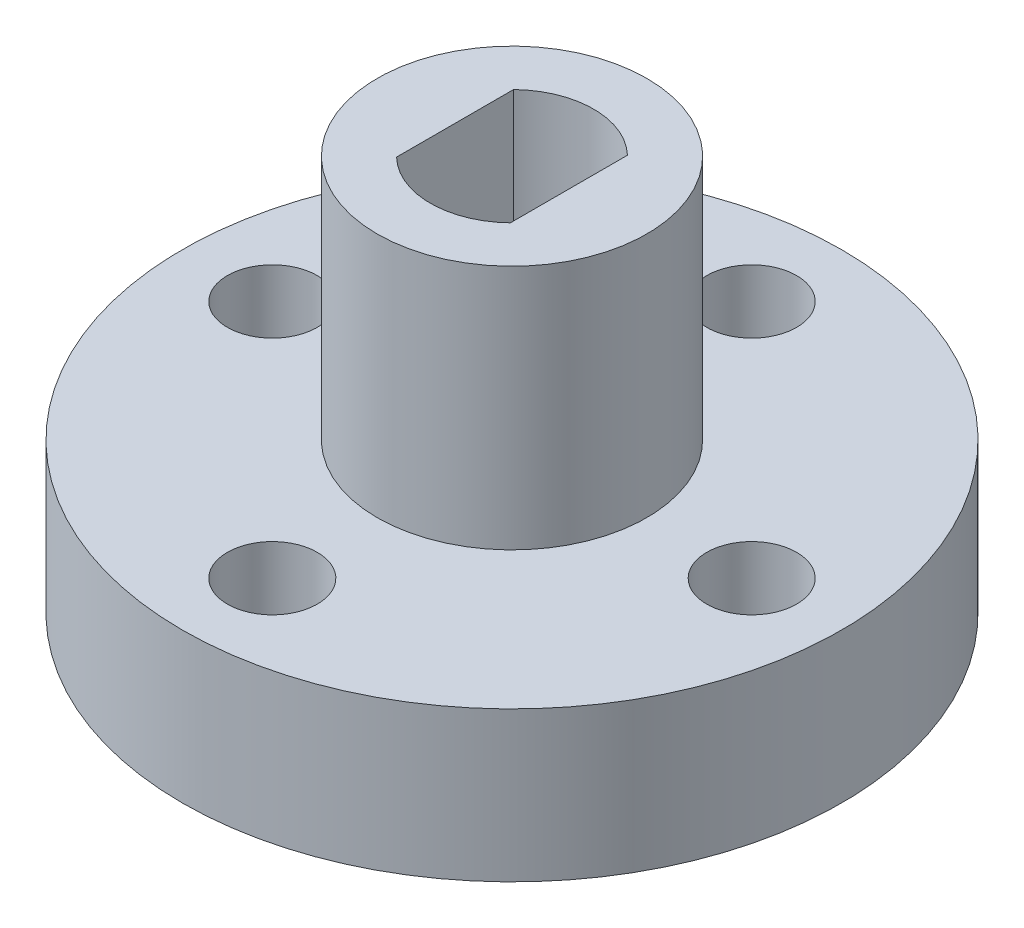
from build123d import *

# Parameters (mm, degrees)
SKETCH1_R           = 4.5
BOSS_EXTRUDE1_DEPTH = 8.2
SKETCH2_R           = 11
BOSS_EXTRUDE2_DEPTH = 5
SKETCH3_R           = 1
CUT_EXTRUDE1_DEPTH  = 21.40196069
SKETCH4_R           = 1.5
CUT_EXTRUDE2_DEPTH  = 21.40196069
CHAMFER1_SIZE       = 1.5
CHAMFER1_SIZE2      = 0.866025404


with BuildPart() as part:
    # Sketch1 → Boss-Extrude1 (new body)
    with BuildSketch(Plane(origin=(0, 0, 0), x_dir=(1, 0, 0), z_dir=(0, 1, 0))):
        Circle(SKETCH1_R)
        with BuildLine():
            Line((-1.9, 1.953362486), (-1.9, -1.953362486))
            ThreePointArc((-1.9, -1.953362486), (0, -2.725), (1.9, -1.953362486))
            Line((1.9, -1.953362486), (1.9, 1.953362486))
            ThreePointArc((1.9, 1.953362486), (0, 2.725), (-1.9, 1.953362486))
        make_face(mode=Mode.SUBTRACT)
    extrude(amount=BOSS_EXTRUDE1_DEPTH)

    # Sketch2 → Boss-Extrude2 (add)
    with BuildSketch(Plane.XZ):
        Circle(SKETCH2_R)
    extrude(amount=BOSS_EXTRUDE2_DEPTH)

    # Sketch3 → Cut-Extrude1 (cut, through all)
    with BuildSketch(Plane.XZ.offset(5)):
        Circle(SKETCH3_R)
    extrude(amount=-CUT_EXTRUDE1_DEPTH, mode=Mode.SUBTRACT)

    # Sketch4 → Cut-Extrude2 (cut, through all)
    with BuildSketch(Plane.XZ.offset(5)):
        with Locations((0, 8)):
            Circle(SKETCH4_R)
        with Locations((-8, 0)):
            Circle(SKETCH4_R)
        with Locations((0, -8)):
            Circle(SKETCH4_R)
        with Locations((8, 0)):
            Circle(SKETCH4_R)
    extrude(amount=-CUT_EXTRUDE2_DEPTH, mode=Mode.SUBTRACT)

    # Chamfer1
    chamfer1_edges = [part.edges().sort_by_distance(p)[0] for p in [
        (-1, -5, 0),
    ]]
    chamfer1_side = [part.faces().sort_by_distance(p)[0] for p in [
        (-10.688873016, -5, 0),
    ]]
    chamfer(chamfer1_edges, length=CHAMFER1_SIZE, length2=CHAMFER1_SIZE2, reference=chamfer1_side[0])


solid = part.part
